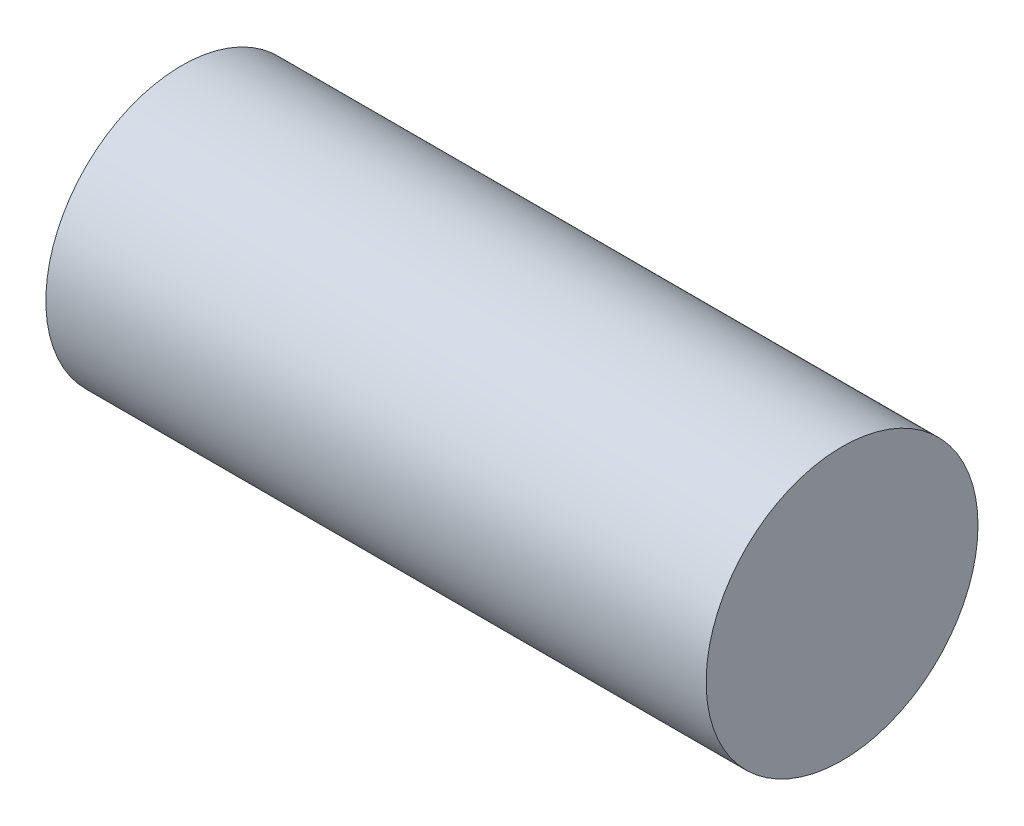
from build123d import *

# Parameters (mm, degrees)
SKETCH1_R           = 1.75
BOSS_EXTRUDE1_DEPTH = 4.25


with BuildPart() as part:
    # Sketch1 → Boss-Extrude1 (new, symmetric)
    with BuildSketch(Plane(origin=(0, 0, 0), x_dir=(0, 0, -1), z_dir=(1, 0, 0))):
        Circle(SKETCH1_R)
    extrude(amount=BOSS_EXTRUDE1_DEPTH, both=True)


solid = part.part
